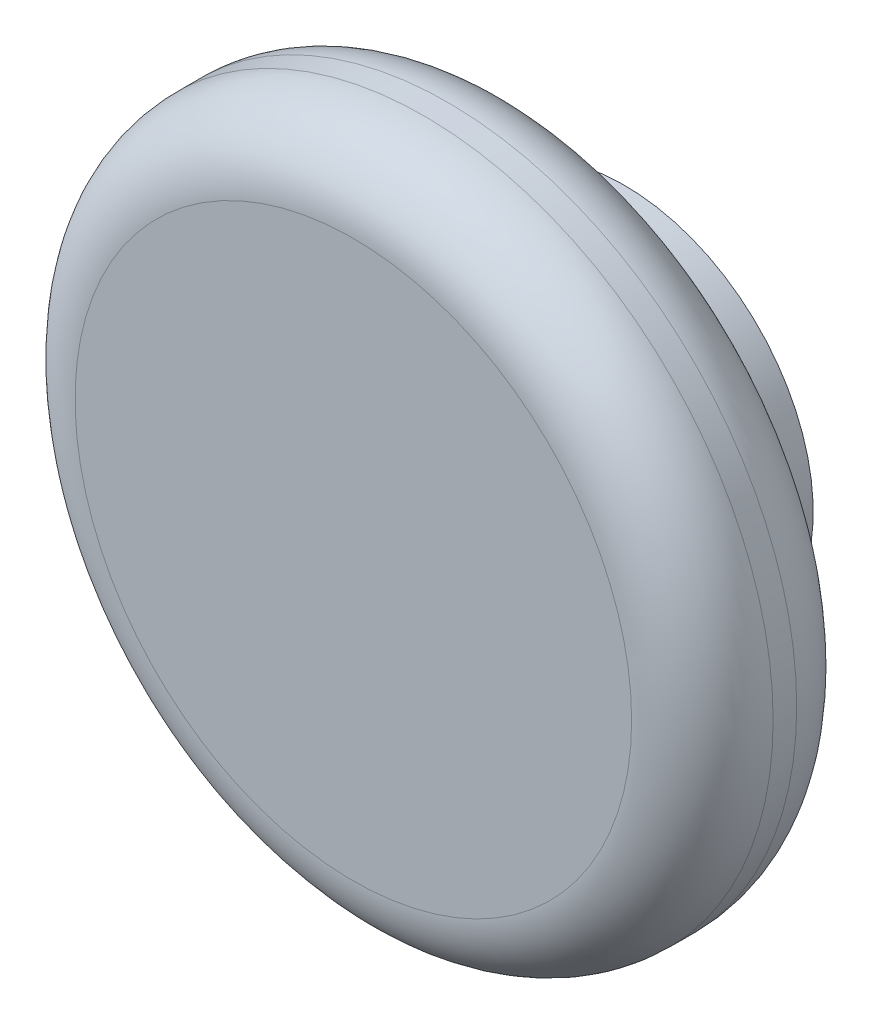
from build123d import *

# Parameters (mm, degrees)
SKETCH1_R           = 7.4
BOSS_EXTRUDE1_DEPTH = 3.5
SKETCH2_R           = 4
BOSS_EXTRUDE2_DEPTH = 2.25
FILLET1_R           = 1.5
FILLET2_R           = 1.5


with BuildPart() as part:
    # Sketch1 → Boss-Extrude1 (new body)
    with BuildSketch(Plane.XY):
        with Locations((-48.895186784, 18.701845636)):
            Circle(SKETCH1_R)
    extrude(amount=BOSS_EXTRUDE1_DEPTH)

    # Sketch2 → Boss-Extrude2 (add)
    with BuildSketch(Plane(origin=(0, 0, 0), x_dir=(-1, 0, 0), z_dir=(0, 0, -1))):
        with Locations((48.895186784, 18.701845636)):
            Circle(SKETCH2_R)
    extrude(amount=BOSS_EXTRUDE2_DEPTH)

    # Fillet1
    fillet1_edges = [part.edges().sort_by_distance(p)[0] for p in [
        (-56.295186784, 18.701845636, 3.5),
    ]]
    fillet(fillet1_edges, radius=FILLET1_R)

    # Fillet2
    fillet2_edges = [part.edges().sort_by_distance(p)[0] for p in [
        (-56.295186784, 18.701845636, 0),
    ]]
    fillet(fillet2_edges, radius=FILLET2_R)


solid = part.part
